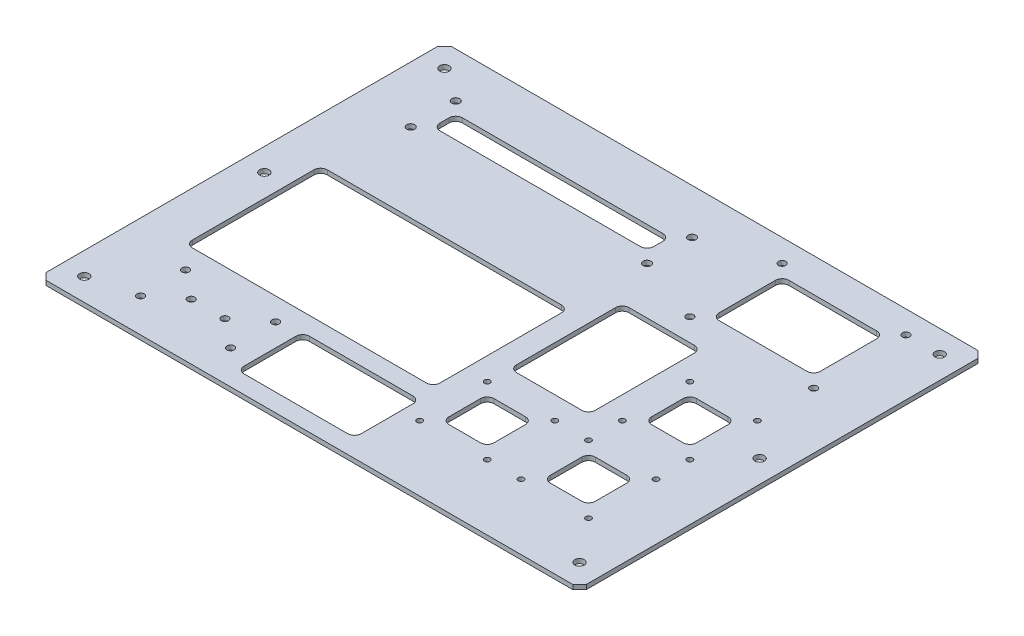
from build123d import *

# Parameters (mm, degrees)
SKETCH_1_W               = 240
SKETCH_1_H               = 180
EXTRUDE_1_DEPTH          = 2
SKETCH_3_R               = 2.1
CUT_EXTRUDE_2_DEPTH      = 10
CUT_EXTRUDE_3_DEPTH      = 151.013332741
CUT_EXTRUDE_3_DEPTH_BACK = 10
SKETCH_4_R               = 1.6
SKETCH_4_R_2             = 1.25
SKETCH_4_R_3             = 1.75
SKETCH_5_R               = 1.6
CUT_EXTRUDE_4_DEPTH      = 10
SKETCH_6_W               = 45
SKETCH_6_H               = 31
SKETCH_6_W_2             = 110
SKETCH_6_H_2             = 60
SKETCH_6_W_3             = 20
SKETCH_6_H_3             = 20
SKETCH_6_W_4             = 35
SKETCH_6_H_4             = 50
SKETCH_6_W_5             = 95
SKETCH_6_H_5             = 10
CUT_EXTRUDE_5_DEPTH      = 10
SKETCH_7_W               = 52
SKETCH_7_H               = 29
CUT_EXTRUDE_6_DEPTH      = 10
FILLET_1_R               = 3
CHAMFER_1_SIZE           = 3


with BuildPart() as part:
    # 草图1 → 凸台-拉伸1 (new body)
    with BuildSketch(Plane(origin=(0, 0, 0), x_dir=(1, 0, 0), z_dir=(0, 1, 0))):
        Rectangle(SKETCH_1_W, SKETCH_1_H)
    extrude(amount=EXTRUDE_1_DEPTH)

    # 草图3 → 切除-拉伸2 (cut)
    with BuildSketch(Plane(origin=(0, 2, 0), x_dir=(1, 0, 0), z_dir=(0, 1, 0))):
        with Locations((-110, 80)):
            Circle(SKETCH_3_R)
        with Locations((-110, 0)):
            Circle(SKETCH_3_R)
        with Locations((-110, -80)):
            Circle(SKETCH_3_R)
        with Locations((110, -80)):
            Circle(SKETCH_3_R)
        with Locations((110, 0)):
            Circle(SKETCH_3_R)
        with Locations((110, 80)):
            Circle(SKETCH_3_R)
    extrude(amount=-CUT_EXTRUDE_2_DEPTH, mode=Mode.SUBTRACT)

    # 草图4 → 切除-拉伸3 (cut, two sides: drawn at the far end of the back side and taken through both)
    with BuildSketch(Plane(origin=(0, 2, 0), x_dir=(1, 0, 0), z_dir=(0, 1, 0)).offset(-CUT_EXTRUDE_3_DEPTH_BACK)):
        with Locations((40, 80)):
            Circle(SKETCH_4_R)
        with Locations((95, 80)):
            Circle(SKETCH_4_R)
        with Locations((40, 39)):
            Circle(SKETCH_4_R)
        with Locations((95, 39)):
            Circle(SKETCH_4_R)
        with Locations((65, 14)):
            Circle(SKETCH_4_R_2)
        with Locations((95, 14)):
            Circle(SKETCH_4_R_2)
        with Locations((95, -16)):
            Circle(SKETCH_4_R_2)
        with Locations((65, -16)):
            Circle(SKETCH_4_R_2)
        with Locations((95, -31)):
            Circle(SKETCH_4_R_2)
        with Locations((65, -31)):
            Circle(SKETCH_4_R_2)
        with Locations((65, -61)):
            Circle(SKETCH_4_R_2)
        with Locations((95, -61)):
            Circle(SKETCH_4_R_2)
        with Locations((50, -31)):
            Circle(SKETCH_4_R_2)
        with Locations((20, -31)):
            Circle(SKETCH_4_R_2)
        with Locations((20, -61)):
            Circle(SKETCH_4_R_2)
        with Locations((50, -61)):
            Circle(SKETCH_4_R_2)
        with Locations((-95, 50)):
            Circle(SKETCH_4_R_3)
        with Locations((-95, 70)):
            Circle(SKETCH_4_R_3)
        with Locations((10, 70)):
            Circle(SKETCH_4_R_3)
        with Locations((10, 50)):
            Circle(SKETCH_4_R_3)
    extrude(amount=CUT_EXTRUDE_3_DEPTH + CUT_EXTRUDE_3_DEPTH_BACK, mode=Mode.SUBTRACT)

    # 草图5 → 切除-拉伸4 (cut)
    with BuildSketch(Plane(origin=(0, 2, 0), x_dir=(1, 0, 0), z_dir=(0, 1, 0))):
        with Locations((-62.5, -65)):
            Circle(SKETCH_5_R)
        with Locations((-77.5, -65)):
            Circle(SKETCH_5_R)
        with Locations((-50, -75)):
            Circle(SKETCH_5_R)
        with Locations((-90, -75)):
            Circle(SKETCH_5_R)
        with Locations((-90, -55)):
            Circle(SKETCH_5_R)
        with Locations((-50, -55)):
            Circle(SKETCH_5_R)
    extrude(amount=-CUT_EXTRUDE_4_DEPTH, mode=Mode.SUBTRACT)

    # 草图6 → 切除-拉伸5 (cut)
    with BuildSketch(Plane(origin=(0, 2, 0), x_dir=(1, 0, 0), z_dir=(0, 1, 0))):
        with Locations((67.5, 59.5)):
            Rectangle(SKETCH_6_W, SKETCH_6_H)
        with Locations((-45, -15)):
            Rectangle(SKETCH_6_W_2, SKETCH_6_H_2)
        with Locations((80, -1)):
            Rectangle(SKETCH_6_W_3, SKETCH_6_H_3)
        with Locations((80, -46)):
            Rectangle(SKETCH_6_W_3, SKETCH_6_H_3)
        with Locations((35, -46)):
            Rectangle(SKETCH_6_W_3, SKETCH_6_H_3)
        with Locations((37.5, 4)):
            Rectangle(SKETCH_6_W_4, SKETCH_6_H_4)
        with Locations((-42.5, 60)):
            Rectangle(SKETCH_6_W_5, SKETCH_6_H_5)
    extrude(amount=-CUT_EXTRUDE_5_DEPTH, mode=Mode.SUBTRACT)

    # 草图7 → 切除-拉伸6 (cut)
    with BuildSketch(Plane(origin=(0, 2, 0), x_dir=(1, 0, 0), z_dir=(0, 1, 0))):
        with Locations((-14, -67.5)):
            Rectangle(SKETCH_7_W, SKETCH_7_H)
    extrude(amount=-CUT_EXTRUDE_6_DEPTH, mode=Mode.SUBTRACT)

    # 圆角1
    fillet_1_edges = [part.edges().sort_by_distance(p)[0] for p in [
        (10, 1, 45),
        (-100, 1, 45),
        (10, 1, -15),
        (90, 1, -9),
        (90, 1, 11),
        (70, 1, 11),
        (70, 1, -9),
        (45, 1, 36),
        (45, 1, 56),
        (25, 1, 56),
        (25, 1, 36),
        (90, 1, -75),
        (90, 1, -44),
        (45, 1, -44),
        (45, 1, -75),
        (90, 1, 36),
        (90, 1, 56),
        (70, 1, 56),
        (70, 1, 36),
        (55, 1, 21),
        (20, 1, 21),
        (20, 1, -29),
        (55, 1, -29),
        (-100, 1, -15),
        (5, 1, -65),
        (5, 1, -55),
        (-90, 1, -55),
        (-90, 1, -65),
        (12, 1, 53),
        (12, 1, 82),
        (-40, 1, 82),
        (-40, 1, 53),
    ]]
    fillet(fillet_1_edges, radius=FILLET_1_R)

    # 倒角1
    chamfer_1_edges = [part.edges().sort_by_distance(p)[0] for p in [
        (-120, 1, 90),
        (120, 1, 90),
        (120, 1, -90),
        (-120, 1, -90),
    ]]
    chamfer(chamfer_1_edges, length=CHAMFER_1_SIZE)


solid = part.part
